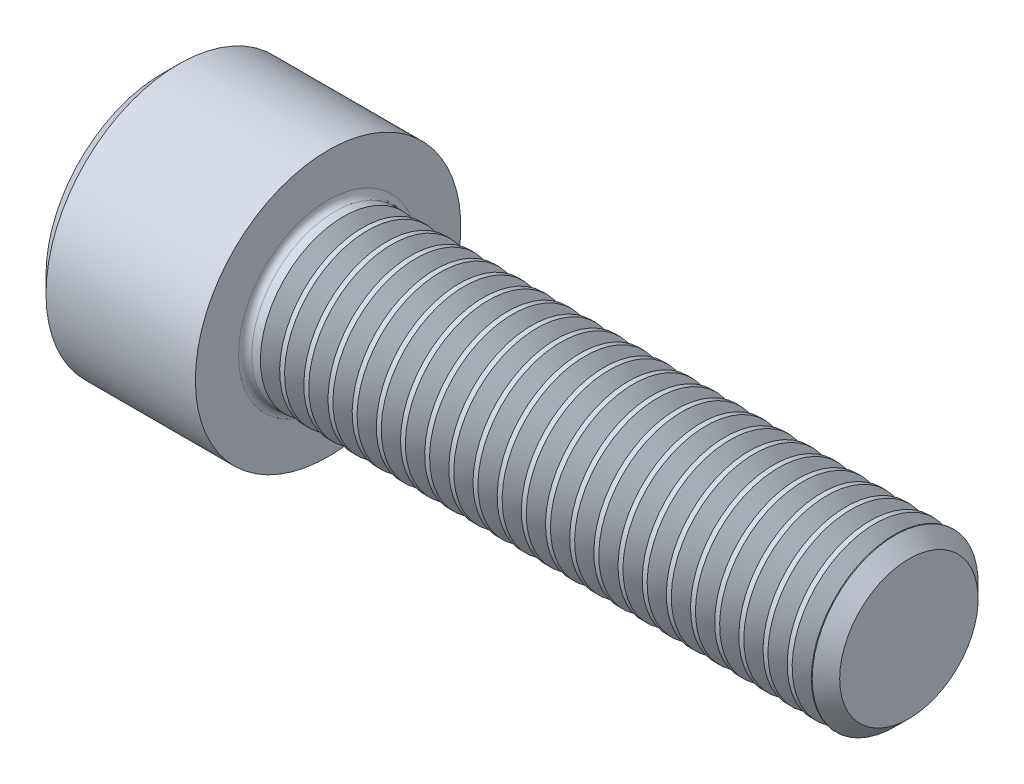
from build123d import *

# Parameters (mm, degrees)
FILLET1_R       = 0.4
HEX_2_DEPTH     = 5
THDSCHPAT_COUNT = 23
THDSCHPAT_PITCH = 1.456521739


with BuildPart() as part:
    # BodySke → Base-Revolve (revolve)
    with BuildSketch(Plane.XY, mode=Mode.PRIVATE) as base_revolve_sk:
        Polygon((0, 0), (0, 7), (1, 8), (10, 8), (10, 5), (44.172, 5), (45, 4.172), (45, 0), align=None)
    revolve(base_revolve_sk.sketch.rotate(Axis((-31.75, 0, 0), (1, 0, 0)), 90), axis=Axis((-31.75, 0, 0), (1, 0, 0)))

    # Fillet1
    fillet1_edges = [part.edges().sort_by_distance(p)[0] for p in [
        (10, 0, -5),
    ]]
    fillet(fillet1_edges, radius=FILLET1_R)

    # Sketch2 → Hex-PreBroach (revolve, cut)
    with BuildSketch(Plane.XY, mode=Mode.PRIVATE) as hex_prebroach_sk:
        Polygon((0, 4.0575), (5, 4.0575), (7.342598717, 0), (0, 0), align=None)
    revolve(hex_prebroach_sk.sketch.rotate(Axis((0, 0, 0), (1, 0, 0)), 90), axis=Axis((0, 0, 0), (1, 0, 0)), mode=Mode.SUBTRACT)

    # Sketch3 → Hex 2 (cut)
    with BuildSketch(Plane(origin=(0, 0, 0), x_dir=(0, 0.500000000000001, 0.866025403784438), z_dir=(-1, 0, 0))):
        Polygon((2.342598717, 4.0575), (-2.342598717, 4.0575), (-4.685197434, 0), (-2.342598717, -4.0575), (2.342598717, -4.0575), (4.685197434, 0), align=None)
    extrude(amount=-HEX_2_DEPTH, mode=Mode.SUBTRACT)

    # ThdSchSke → ThreadSchematic (revolve, cut)
    with BuildSketch(Plane.XY):
        Polygon((11.5, -4.172), (10.920228158, -5), (10.920228158, -6.25), (12.079771842, -6.25), (12.079771842, -5), align=None)
    threadschematic = revolve(axis=Axis((-3.175, 0, 0), (1, 0, 0)), mode=Mode.SUBTRACT)

    # ThdSchPat: ThreadSchematic ×23
    with Locations(*[(i * THDSCHPAT_PITCH, 0, 0) for i in range(1, THDSCHPAT_COUNT)]):
        add(threadschematic, mode=Mode.SUBTRACT)


solid = part.part
